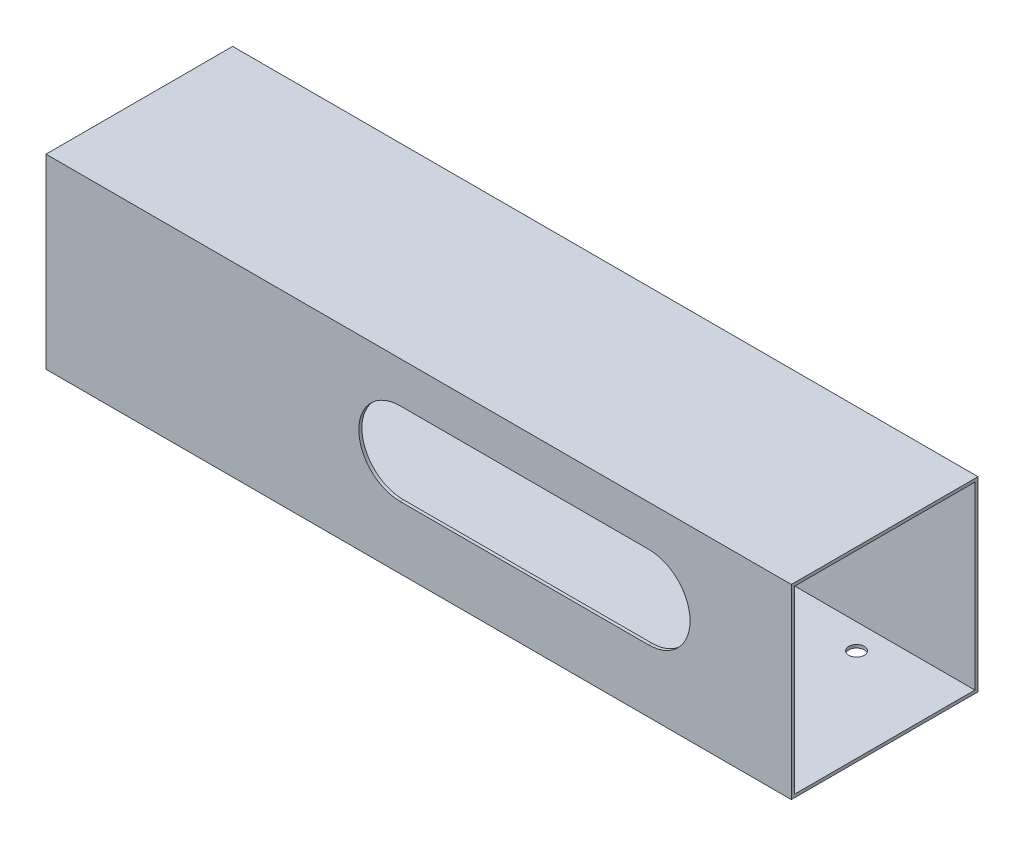
from build123d import *

# Parameters (mm, degrees)
ESBO_O2_W                = 60.1
ESBO_O2_H                = 60
ESBO_O2_W_2              = 58.1
ESBO_O2_H_2              = 58
RESSALTO_EXTRUS_O3_DEPTH = 240
ESBO_O4_R                = 2
ESBO_O4_R_2              = 2.5
CORTE_EXTRUS_O1_DEPTH    = 246.345874994
CORTE_EXTRUS_O2_DEPTH    = 10


with BuildPart() as part:
    # Esboço2 → Ressalto-extrusão3 (new body)
    with BuildSketch(Plane(origin=(0, 0, 0), x_dir=(0, 0, -1), z_dir=(1, 0, 0))):
        with Locations((0.05, 11.092436975)):
            Rectangle(ESBO_O2_W, ESBO_O2_H)
        with Locations((0.05, 11.092436975)):
            Rectangle(ESBO_O2_W_2, ESBO_O2_H_2, mode=Mode.SUBTRACT)
    extrude(amount=RESSALTO_EXTRUS_O3_DEPTH)

    # Esboço4 → Corte-extrusão1 (cut, through all)
    with BuildSketch(Plane(origin=(0, 0, 0), x_dir=(1, 0, 0), z_dir=(0, 1, 0))):
        with Locations(Location((12, 15, 0), (0, 0, 270))):
            Circle(ESBO_O4_R)
        with Locations(Location((12, -15, 0), (0, 0, 270))):
            Circle(ESBO_O4_R)
        with Locations(Location((42, -15, 0), (0, 0, 270))):
            Circle(ESBO_O4_R)
        with Locations(Location((42, 15, 0), (0, 0, 270))):
            Circle(ESBO_O4_R)
        with Locations(Location((210, -21, 0), (0, 0, 270))):
            Circle(ESBO_O4_R_2)
        with Locations(Location((210, 21, 0), (0, 0, 270))):
            Circle(ESBO_O4_R_2)
        with Locations(Location((99, -21, 0), (0, 0, 270))):
            Circle(ESBO_O4_R_2)
        with Locations(Location((99, 21, 0), (0, 0, 270))):
            Circle(ESBO_O4_R_2)
    extrude(amount=-CORTE_EXTRUS_O1_DEPTH, mode=Mode.SUBTRACT)

    # Esboço5 → Corte-extrusão2 (cut)
    with BuildSketch(Plane.XY.offset(30)):
        with BuildLine():
            Line((194.051333541, 1.259947871), (114.051333541, 1.259947871))
            ThreePointArc((114.051333541, 1.259947871), (100.718844437, 14.592436975), (114.051333541, 27.924926079))
            Line((114.051333541, 27.924926079), (194.051333541, 27.924926079))
            ThreePointArc((194.051333541, 27.924926079), (207.383822645, 14.592436975), (194.051333541, 1.259947871))
        make_face()
    extrude(amount=-CORTE_EXTRUS_O2_DEPTH, mode=Mode.SUBTRACT)


solid = part.part
